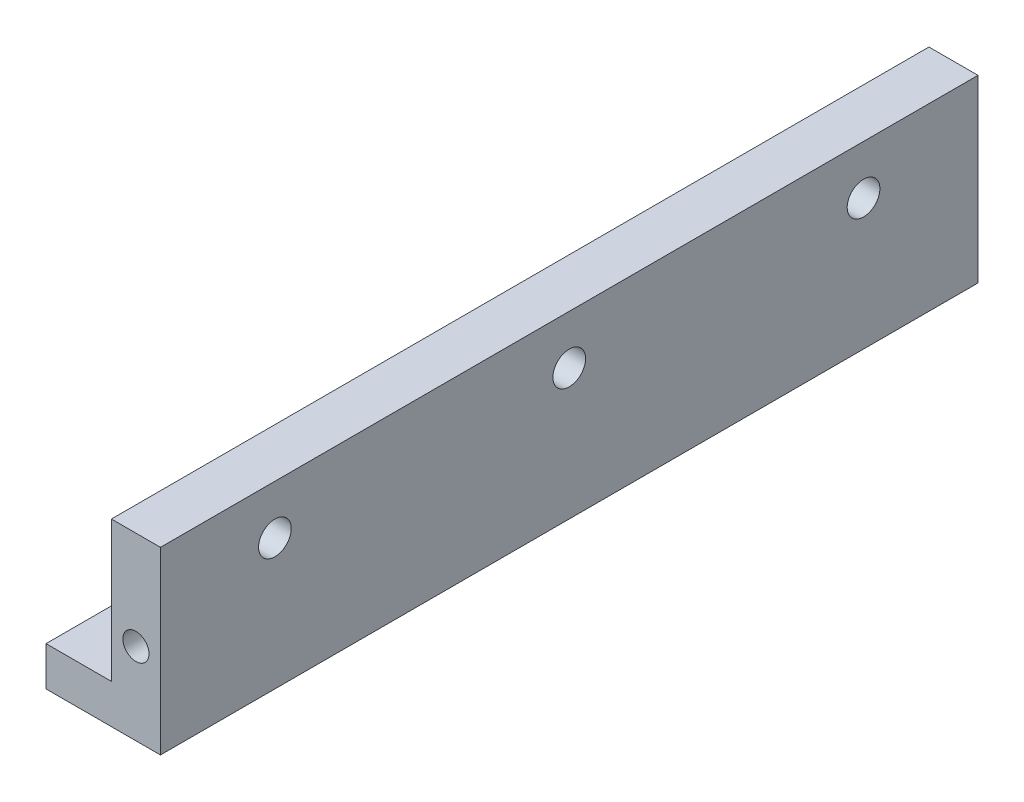
from build123d import *

# Parameters (mm, degrees)
SKETCH_1_R                      = 4
EXTRUDE_1_DEPTH                 = 250
CUT_EXTRUDE_1_REACH             = 329.604
SKETCH_2_R                      = 5
CUT_EXTRUDE_1_DIRECTION_2_DEPTH = 328.604367435


with BuildPart() as part:
    # 草圖1 → 填料-伸長1 (new body)
    with BuildSketch(Plane.XY):
        Polygon((-5.019605957, 208.805223982), (-5.019605957, 165.805223982), (-25.019605957, 165.805223982), (-25.019605957, 153.805223982), (9.980394043, 153.805223982), (9.980394043, 208.805223982), align=None)
        with Locations((2.480394043, 178.805223982)):
            Circle(SKETCH_1_R, mode=Mode.SUBTRACT)
    extrude(amount=-EXTRUDE_1_DEPTH)

    # 草圖2 → 除料-伸長1 (cut, up to next)
    with BuildSketch(Plane(origin=(9.980394043, 0, 0), x_dir=(0, 0, -1), z_dir=(1, 0, 0)), mode=Mode.PRIVATE) as cut_extrude_1_sk1:
        with Locations(Location((35, 193.805223982, 0), (0, 0, 270))):
            Circle(SKETCH_2_R)
    cut_extrude_1_tool1 = extrude(cut_extrude_1_sk1.sketch, amount=-CUT_EXTRUDE_1_REACH, mode=Mode.PRIVATE) & part.part
    # 草圖2 → 除料-伸長1 (cut, up to next)
    with BuildSketch(Plane(origin=(9.980394043, 0, 0), x_dir=(0, 0, -1), z_dir=(1, 0, 0)), mode=Mode.PRIVATE) as cut_extrude_1_sk2:
        with Locations(Location((125, 193.805223982, 0), (0, 0, 270))):
            Circle(SKETCH_2_R)
    cut_extrude_1_tool2 = extrude(cut_extrude_1_sk2.sketch, amount=-CUT_EXTRUDE_1_REACH, mode=Mode.PRIVATE) & part.part
    # 草圖2 → 除料-伸長1 (cut, up to next)
    with BuildSketch(Plane(origin=(9.980394043, 0, 0), x_dir=(0, 0, -1), z_dir=(1, 0, 0)), mode=Mode.PRIVATE) as cut_extrude_1_sk3:
        with Locations(Location((215, 193.805223982, 0), (0, 0, 270))):
            Circle(SKETCH_2_R)
    cut_extrude_1_tool3 = extrude(cut_extrude_1_sk3.sketch, amount=-CUT_EXTRUDE_1_REACH, mode=Mode.PRIVATE) & part.part
    add(cut_extrude_1_tool1.solids().sort_by_distance((9.980394, 193.805224, -35))[0], mode=Mode.SUBTRACT)
    add(cut_extrude_1_tool2.solids().sort_by_distance((9.980394, 193.805224, -125))[0], mode=Mode.SUBTRACT)
    add(cut_extrude_1_tool3.solids().sort_by_distance((9.980394, 193.805224, -215))[0], mode=Mode.SUBTRACT)

    # 草圖2 → 除料-伸長1 direction 2 (cut)
    with BuildSketch(Plane(origin=(9.980394043, 0, 0), x_dir=(0, 0, -1), z_dir=(1, 0, 0))):
        with Locations(Location((35, 193.805223982, 0), (0, 0, 270))):
            Circle(SKETCH_2_R)
        with Locations(Location((125, 193.805223982, 0), (0, 0, 270))):
            Circle(SKETCH_2_R)
        with Locations(Location((215, 193.805223982, 0), (0, 0, 270))):
            Circle(SKETCH_2_R)
    extrude(amount=CUT_EXTRUDE_1_DIRECTION_2_DEPTH, mode=Mode.SUBTRACT)


solid = part.part
